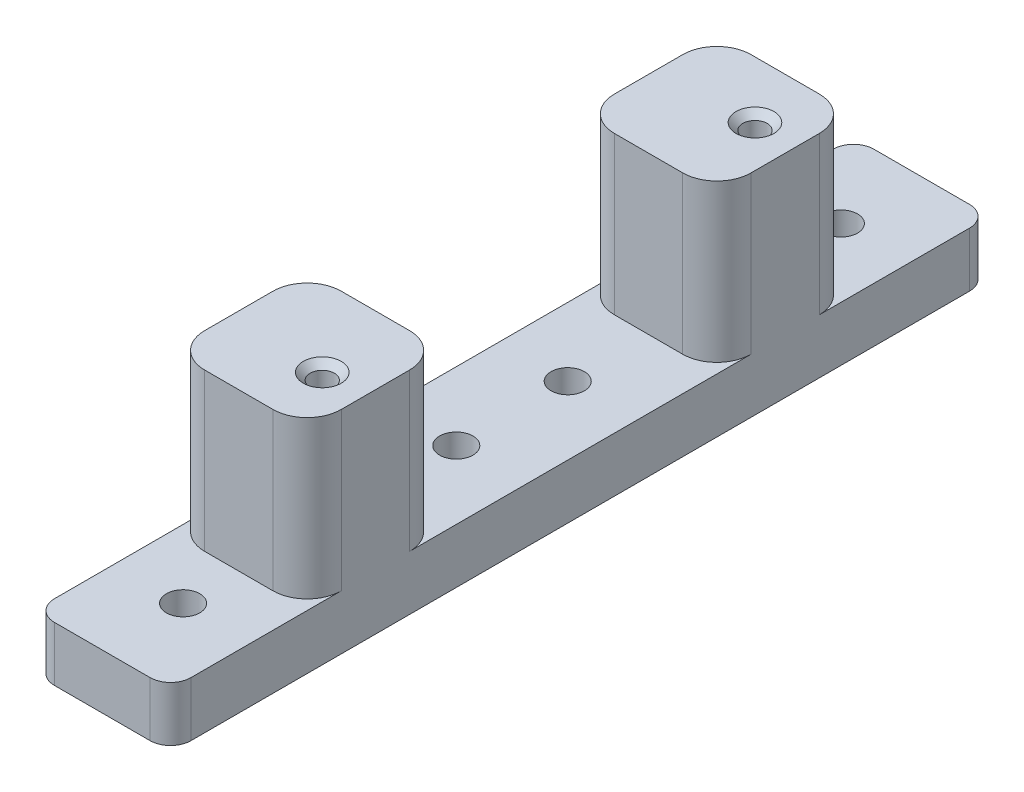
from build123d import *

# Parameters (mm, degrees)
SKETCH1_W                = 10
SKETCH1_H                = 60
BOSS_EXTRUDE1_DEPTH      = 4
F_2_CLEARANCE_HOLE1_D    = 2.4384
FILLET1_R                = 1.5
SKETCH4_W                = 10
SKETCH4_H                = 10
BOSS_EXTRUDE2_DEPTH      = 11.5
FILLET2_R                = 2.5
CHAMFER1_SIZE            = 0.5
FILLET2_OF_MIRROR1_R     = 2.5
CHAMFER1_OF_MIRROR1_SIZE = 0.5


with BuildPart() as part:
    # Sketch1 → Boss-Extrude1 (new body)
    with BuildSketch(Plane(origin=(0, 0, 0), x_dir=(1, 0, 0), z_dir=(0, 1, 0))):
        Rectangle(SKETCH1_W, SKETCH1_H)
    extrude(amount=BOSS_EXTRUDE1_DEPTH)

    # #2 Clearance Hole1 (through all)
    with Locations(Plane(origin=(0, 4, 0), x_dir=(1, 0, 0), z_dir=(0, 1, 0))):
        with Locations((0, -4.08), (0, 24.08), (0, 4.08), (0, -24.08)):
            Hole(F_2_CLEARANCE_HOLE1_D / 2)

    # Fillet1
    fillet1_edges = [part.edges().sort_by_distance(p)[0] for p in [
        (5, 2, 30),
        (-5, 2, 30),
        (-5, 2, -30),
        (5, 2, -30),
    ]]
    fillet(fillet1_edges, radius=FILLET1_R)

    # Sketch4 → Boss-Extrude2 (add)
    with BuildSketch(Plane(origin=(0, 4, 0), x_dir=(1, 0, 0), z_dir=(0, 1, 0))):
        with Locations((0, -15)):
            Rectangle(SKETCH4_W, SKETCH4_H)
    boss_extrude2 = extrude(amount=BOSS_EXTRUDE2_DEPTH)

    # Fillet2
    fillet2_edges = [part.edges().sort_by_distance(p)[0] for p in [
        (-5, 9.75, 10),
        (-5, 9.75, 20),
        (5, 9.75, 20),
        (5, 9.75, 10),
    ]]
    fillet(fillet2_edges, radius=FILLET2_R)

    # Sketch6 → Tap Drill for #2-56 Tap1 (revolve, cut)
    with BuildSketch(Plane(origin=(1.95, 15.5, 15.84), x_dir=(0, 0, 1), z_dir=(1, 0, 0))):
        Polygon((0, 0), (0, 10.69416509), (0.889, 10.16), (0.889, 0), align=None)
    tap_drill_for_2_56_tap1 = revolve(axis=Axis((1.95, 21.85, 15.84), (0, -1, 0)), mode=Mode.SUBTRACT)

    # Chamfer1
    chamfer1_edges = [part.edges().sort_by_distance(p)[0] for p in [
        (1.95, 15.5, 14.951),
    ]]
    chamfer(chamfer1_edges, length=CHAMFER1_SIZE)

    # Mirror1: Boss-Extrude2, Tap Drill for #2-56 Tap1 across plane
    add(boss_extrude2.mirror(Plane.XY))
    add(tap_drill_for_2_56_tap1.mirror(Plane.XY), mode=Mode.SUBTRACT)

    # Fillet2 of Mirror1
    fillet2_of_mirror1_edges = [part.edges().sort_by_distance(p)[0] for p in [
        (-5, 9.75, -10),
        (-5, 9.75, -20),
        (5, 9.75, -20),
        (5, 9.75, -10),
    ]]
    fillet(fillet2_of_mirror1_edges, radius=FILLET2_OF_MIRROR1_R)

    # Chamfer1 of Mirror1
    chamfer1_of_mirror1_edges = [part.edges().sort_by_distance(p)[0] for p in [
        (1.95, 15.5, -14.951),
    ]]
    chamfer(chamfer1_of_mirror1_edges, length=CHAMFER1_OF_MIRROR1_SIZE)


solid = part.part
